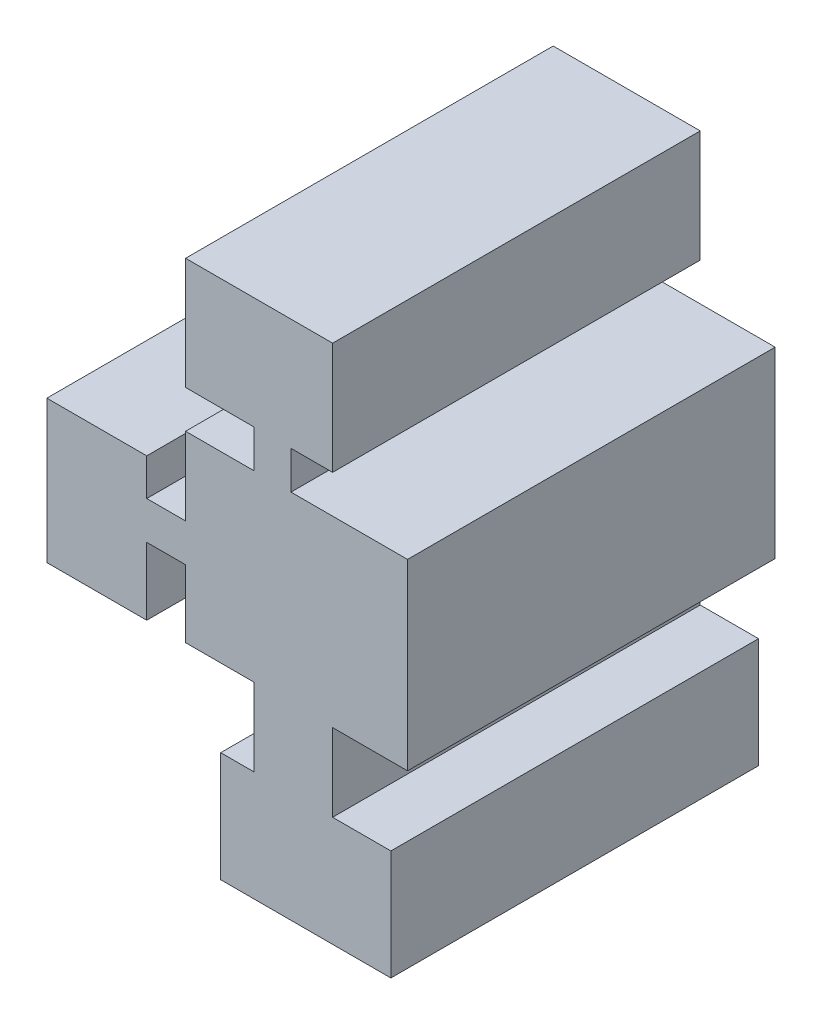
from build123d import *

# Parameters (mm, degrees)
BOSS_EXTRUDE1_DEPTH = 10


with BuildPart() as part:
    # Sketch1 → Boss-Extrude1 (new body)
    with BuildSketch(Plane.XY):
        Polygon((543.090633102, 88.975894456), (543.090633102, 83.995116821), (541.053042252, 83.995116821), (541.053042252, 81.882059642), (542.637835136, 81.882059642), (542.637835136, 78.888561973), (538.009233697, 78.888561973), (538.009233697, 81.882059642), (538.91482963, 81.882059642), (538.91482963, 83.995116821), (537.053326878, 83.995116821), (537.053326878, 85.831464131), (535.996798289, 85.831464131), (535.996798289, 83.995116821), (533.280010488, 83.995116821), (533.280010488, 87.869054981), (535.996798289, 87.869054981), (535.996798289, 86.862837277), (537.053326878, 86.862837277), (537.053326878, 88.975894456), (538.91482963, 88.975894456), (538.91482963, 90.007267603), (537.053326878, 90.007267603), (537.053326878, 93.051076157), (541.053042252, 93.051076157), (541.053042252, 90.007267603), (539.921047335, 90.007267603), (539.921047335, 88.975894456), align=None)
    extrude(amount=BOSS_EXTRUDE1_DEPTH)


solid = part.part
